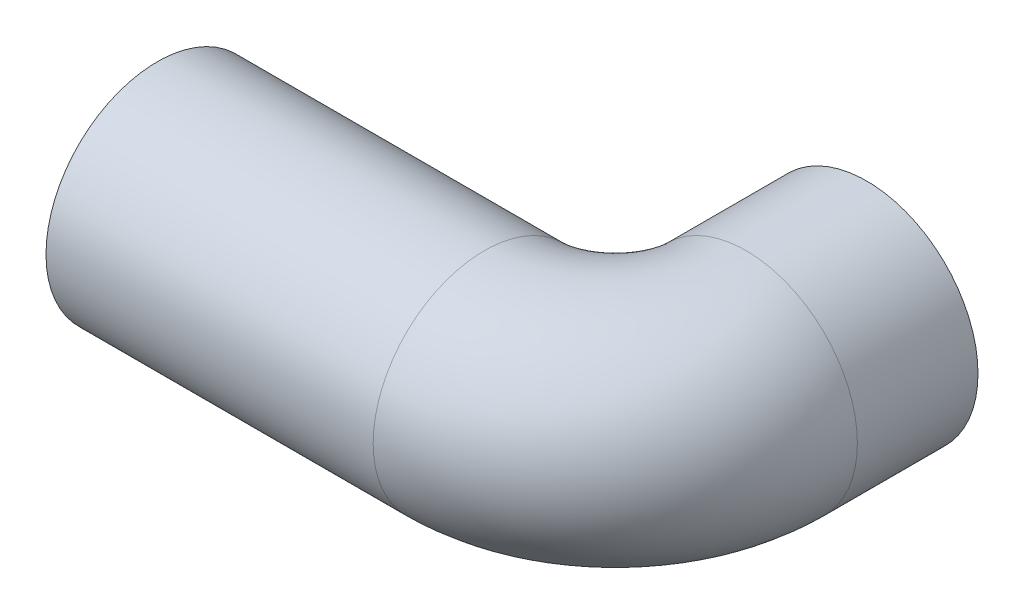
from build123d import *

# Parameters (mm, degrees)
SWEEP1_PROFILE_R = 34
SHELL1_T         = -0.5


with BuildPart() as part:
    # Sweep1: sweep along a curve in space
    with BuildLine() as sweep1_path:
        Line((0, 0, 0), (0, 0, 36.87))
        ThreePointArc((0, 0, 36.87), (-11.715728753, 0, 65.154271247), (-40, 0, 76.87))
        Line((-40, 0, 76.87), (-140, 0, 76.87))
    # Sweep1 profile (on start of the path) → Sweep1 (sweep)
    with BuildSketch(Plane.XY):
        Circle(SWEEP1_PROFILE_R)
    sweep(path=sweep1_path.line)

    # Shell1
    shell1_openings = [part.faces().sort_by_distance(p)[0] for p in [
        (0, 0, 0),
    ]]
    offset(amount=SHELL1_T, openings=shell1_openings, kind=Kind.INTERSECTION)


solid = part.part
